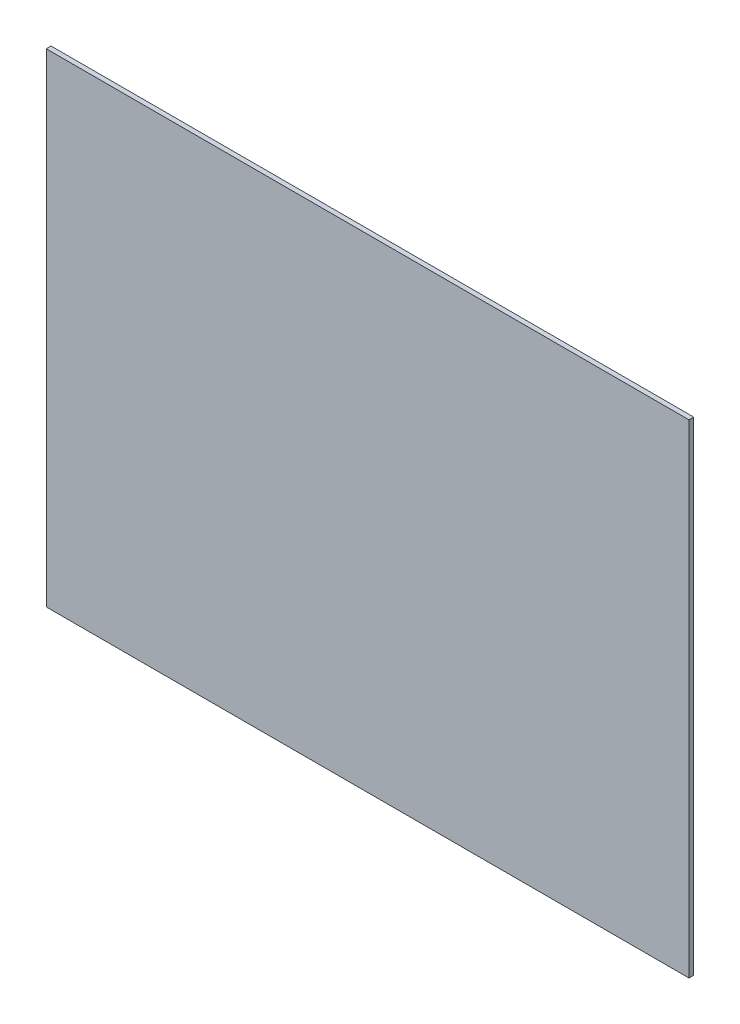
from build123d import *

# Parameters (mm, degrees)
SKETCH_1_W      = 807
SKETCH_1_H      = 607
EXTRUDE_1_DEPTH = 6


with BuildPart() as part:
    # Эскиз1 → Бобышка-Вытянуть1 (new body)
    with BuildSketch(Plane.XY):
        Rectangle(SKETCH_1_W, SKETCH_1_H)
    extrude(amount=EXTRUDE_1_DEPTH)


solid = part.part
